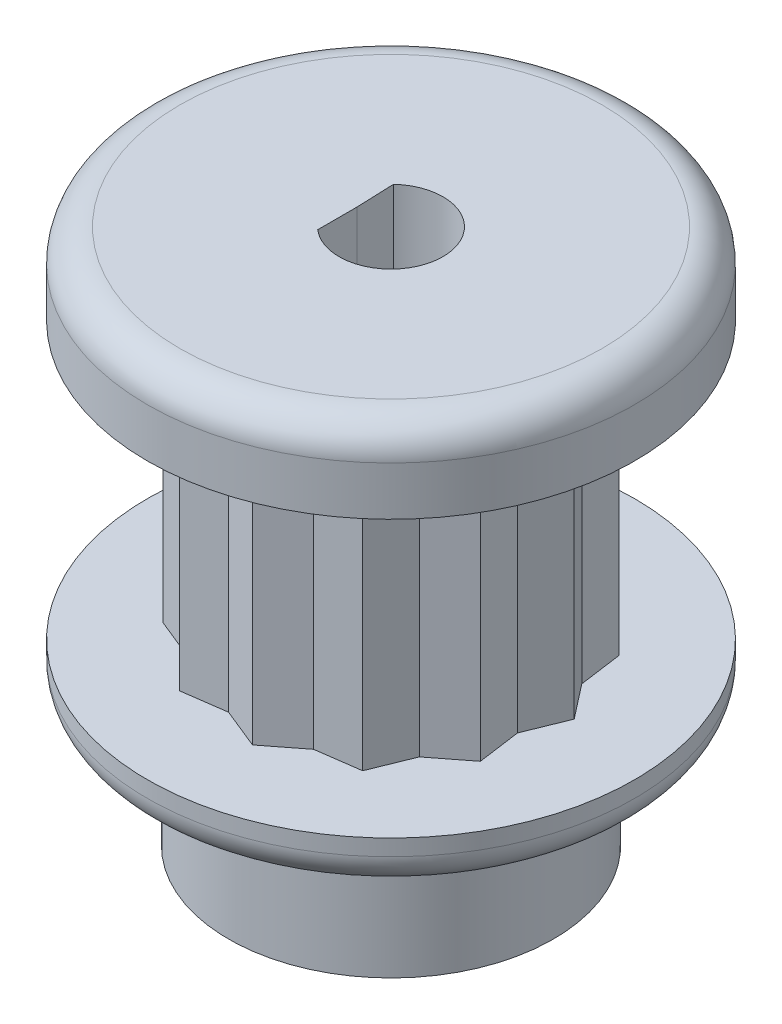
from build123d import *

# Parameters (mm, degrees)
BOSS_EXTRU_2_DEPTH      = 8.5
ESQUISSE2_R             = 7.5
BOSS_EXTRU_3_DEPTH      = 2.5
BOSS_EXTRU_4_START      = 1.5
ESQUISSE3_R             = 7.5
BOSS_EXTRU_4_DEPTH      = 1.5
ESQUISSE4_R             = 5
BOSS_EXTRU_5_DEPTH      = 4
ESQUISSE6_R             = 3
ENL_V_MAT_EXTRU_2_DEPTH = 0.1
CONG_4_R                = 1
ENL_V_MAT_EXTRU_3_DEPTH = 20.531001075


with BuildPart() as part:
    # Esquisse1 → Boss.-Extru.2 (new body)
    with BuildSketch(Plane(origin=(0, 0, 0), x_dir=(1, 0, 0), z_dir=(0, 1, 0))):
        Polygon((0.553357943, 4.448593533), (-0.688038008, 4.952434119), (-1.74507473, 4.129273982), (-3.072075453, 3.944914754), (-3.575916039, 2.703518803), (-4.632952761, 1.880358666), (-4.448593533, 0.553357943), (-4.952434119, -0.688038008), (-4.129273982, -1.74507473), (-3.944914754, -3.072075453), (-2.703518803, -3.575916039), (-1.880358666, -4.632952761), (-0.553357943, -4.448593533), (0.688038008, -4.952434119), (1.74507473, -4.129273982), (3.072075453, -3.944914754), (3.575916039, -2.703518803), (4.632952761, -1.880358666), (4.448593533, -0.553357943), (4.952434119, 0.688038008), (4.129273982, 1.74507473), (3.944914754, 3.072075453), (2.703518803, 3.575916039), (1.880358666, 4.632952761), align=None)
    extrude(amount=BOSS_EXTRU_2_DEPTH)

    # Esquisse2 → Boss.-Extru.3 (add)
    with BuildSketch(Plane(origin=(0, 8.5, 0), x_dir=(1, 0, 0), z_dir=(0, 1, 0))):
        with Locations(Location((0, 0, 0), (0, 0, 270))):
            Circle(ESQUISSE2_R)
    extrude(amount=BOSS_EXTRU_3_DEPTH)

    # Esquisse3 → Boss.-Extru.4 (add)
    with BuildSketch(Plane.XZ.offset(BOSS_EXTRU_4_START)):
        with Locations(Location((0, 0, 0), (0, 0, 90))):
            Circle(ESQUISSE3_R)
    extrude(amount=-BOSS_EXTRU_4_DEPTH)

    # Esquisse4 → Boss.-Extru.5 (add)
    with BuildSketch(Plane.XZ.offset(1.5)):
        with Locations(Location((0, 0, 0), (0, 0, 270))):
            Circle(ESQUISSE4_R)
    extrude(amount=BOSS_EXTRU_5_DEPTH)

    # Esquisse6 → Enlèv. mat.-Extru.2 (cut)
    with BuildSketch(Plane.XZ.offset(5.5)):
        with Locations(Location((0, 0, 0), (0, 0, 270))):
            Circle(ESQUISSE6_R)
    extrude(amount=-ENL_V_MAT_EXTRU_2_DEPTH, mode=Mode.SUBTRACT)

    # Congé4
    cong_4_edges = [part.edges().sort_by_distance(p)[0] for p in [
        (0, 11, -7.5),
        (0, -1.5, -7.5),
    ]]
    fillet(cong_4_edges, radius=CONG_4_R)

    # Esquisse7 → Enlèv. mat.-Extru.3 (cut, through all)
    with BuildSketch(Plane.XZ.offset(5.4)):
        with BuildLine():
            Line((-1.048275862, 0), (-1.092437897, -1.169007888))
            ThreePointArc((-1.092437897, -1.169007888), (1.599724111, -0.029711421), (-1.048275862, 1.208767023))
            Line((-1.048275862, 1.208767023), (-1.048275862, 0))
        make_face()
    extrude(amount=-ENL_V_MAT_EXTRU_3_DEPTH, mode=Mode.SUBTRACT)


solid = part.part
